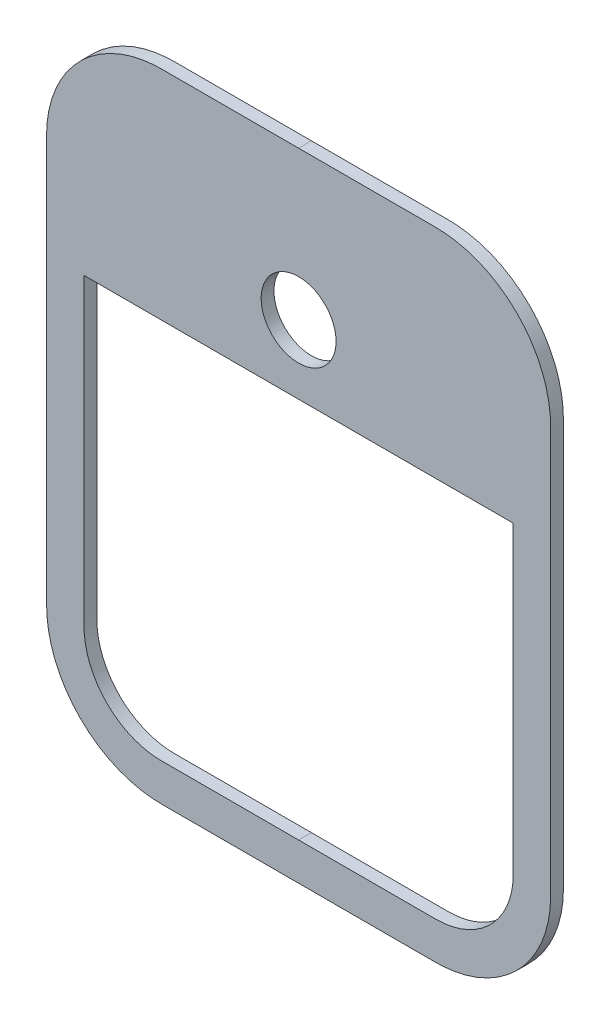
from build123d import *

# Parameters (mm, degrees)
SKETCH_1_R      = 8.2
EXTRUDE_1_DEPTH = 1.4


with BuildPart() as part:
    # Эскиз1 → Бобышка-Вытянуть1 (new, symmetric)
    # profile 1 of 2: a face of its own
    with BuildSketch(Plane.XY):
        with BuildLine():
            add(Edge.make_bspline(
                [(0, 136.205165198), (-2.37042379, 136.205165198), (-7.111202575, 136.205106755), (-14.222783524, 136.205369748), (-20.14789707, 136.204566159), (-24.890670897, 136.206202559), (-28.440424626, 136.201205693), (-32.018143408, 136.219965858), (-35.574450555, 135.66555445), (-39.012954408, 134.629996863), (-43.356980775, 132.607591094), (-48.165067718, 128.962283884), (-51.754969573, 124.112531724), (-53.726745969, 119.745405892), (-54.724040389, 116.295495654), (-55.232371711, 112.731998836), (-55.191339866, 109.158613452), (-55.202268827, 105.607705457), (-55.198690162, 100.86530983), (-55.200444409, 94.940009072), (-55.19988305, 87.828495474), (-55.20007017, 78.346878276), (-55.19995322, 66.494731483), (-55.20007017, 54.642584691), (-55.19988305, 45.160967492), (-55.200444409, 38.049453894), (-55.198690162, 32.124153137), (-55.202268827, 27.381757509), (-55.191339866, 23.830849514), (-55.232371711, 20.257464131), (-54.724040389, 16.693967312), (-53.726745969, 13.244057074), (-51.754969573, 8.876931242), (-48.165067718, 4.027179082), (-43.356980775, 0.381871873), (-39.012954408, -1.640533897), (-35.574450555, -2.676091484), (-32.018143408, -3.230502891), (-28.440424626, -3.211742727), (-24.890670897, -3.216739593), (-20.14789707, -3.215103193), (-14.222783524, -3.215906782), (-7.111202575, -3.215643789), (-2.37042379, -3.215702232), (0, -3.215702232)],
                knots=[0, 0, 0, 0, 0.03125, 0.0625, 0.09375, 0.109375, 0.125, 0.140625, 0.15625, 0.171875, 0.1875, 0.21875, 0.25, 0.265625, 0.28125, 0.296875, 0.3125, 0.328125, 0.34375, 0.375, 0.40625, 0.4375, 0.5, 0.5625, 0.59375, 0.625, 0.65625, 0.671875, 0.6875, 0.703125, 0.71875, 0.734375, 0.75, 0.78125, 0.8125, 0.828125, 0.84375, 0.859375, 0.875, 0.890625, 0.90625, 0.9375, 0.96875, 1, 1, 1, 1], degree=3))
            add(Edge.make_bspline(
                [(0, -3.215702232), (2.37042379, -3.215702232), (7.111202575, -3.215643789), (14.222783524, -3.215906782), (20.14789707, -3.215103193), (24.890670897, -3.216739593), (28.440424626, -3.211742727), (32.018143408, -3.230502891), (35.574450555, -2.676091484), (39.012954408, -1.640533897), (43.356980775, 0.381871873), (48.165067718, 4.027179082), (51.754969573, 8.876931242), (53.726745969, 13.244057074), (54.724040389, 16.693967312), (55.232371711, 20.257464131), (55.191339866, 23.830849514), (55.202268827, 27.381757509), (55.198690162, 32.124153137), (55.200444409, 38.049453894), (55.19988305, 45.160967492), (55.20007017, 54.642584691), (55.19995322, 66.494731483), (55.20007017, 78.346878276), (55.19988305, 87.828495474), (55.200444409, 94.940009072), (55.198690162, 100.86530983), (55.202268827, 105.607705457), (55.191339866, 109.158613452), (55.232371711, 112.731998836), (54.724040389, 116.295495654), (53.726745969, 119.745405892), (51.754969573, 124.112531724), (48.165067718, 128.962283884), (43.356980775, 132.607591094), (39.012954408, 134.629996863), (35.574450555, 135.66555445), (32.018143408, 136.219965858), (28.440424626, 136.201205693), (24.890670897, 136.206202559), (20.14789707, 136.204566159), (14.222783524, 136.205369748), (7.111202575, 136.205106755), (2.37042379, 136.205165198), (0, 136.205165198)],
                knots=[0, 0, 0, 0, 0.03125, 0.0625, 0.09375, 0.109375, 0.125, 0.140625, 0.15625, 0.171875, 0.1875, 0.21875, 0.25, 0.265625, 0.28125, 0.296875, 0.3125, 0.328125, 0.34375, 0.375, 0.40625, 0.4375, 0.5, 0.5625, 0.59375, 0.625, 0.65625, 0.671875, 0.6875, 0.703125, 0.71875, 0.734375, 0.75, 0.78125, 0.8125, 0.828125, 0.84375, 0.859375, 0.875, 0.890625, 0.90625, 0.9375, 0.96875, 1, 1, 1, 1], degree=3))
        make_face()
        with BuildLine():
            add(Edge.make_bspline(
                [(0, 4.984297768), (2.37042379, 4.984297768), (7.111276748, 4.984297736), (13.037316056, 4.984297855), (17.778203974, 4.984297618), (20.741131183, 4.984298219), (23.111765404, 4.984296986), (24.888940349, 4.984300752), (26.669171945, 4.984286613), (28.143176701, 4.984330606), (29.193638048, 4.984252104), (29.693381108, 4.984362158), (30.019976191, 4.984184709), (30.190434528, 4.98491178), (30.457102871, 4.989488256), (30.853917852, 5.003810956), (31.359926967, 5.03520674), (31.961162219, 5.094274236), (32.760894573, 5.201478452), (34.145142461, 5.462928318), (36.081410013, 6.047696592), (39.010301866, 7.411036383), (42.254095787, 9.870032114), (44.67625635, 13.142689017), (46.005496468, 16.086795153), (46.568001427, 18.029390949), (46.813468913, 19.41687133), (46.911496426, 20.217871664), (46.963639674, 20.820007508), (46.989223321, 21.325361879), (46.997721568, 21.674134537), (46.999616457, 21.855301499), (47.000027494, 21.947801949), (46.999966364, 22.14861745), (47.000012874, 22.498249155), (46.999992568, 23.083742615), (47.000002521, 23.827986136), (46.999999341, 24.715781241), (47.000000376, 25.901355742), (46.99999973, 27.975250245), (47.000000092, 30.938406753), (46.999999976, 34.494001915), (47.000000014, 39.23486276), (46.999999995, 45.160915726), (47.000000001, 52.272189184), (47, 59.383460003), (47, 66.494731483), (47, 73.606002963), (47.000000001, 80.669302332), (47, 85.954784691), (47, 90.695632571), (47.00000001, 94.299236223), (46.999999976, 98.495461052), (47.000000092, 102.051056214), (46.99999973, 105.014212722), (47.000000376, 107.088107224), (46.999999341, 108.273681725), (47.000002521, 109.16147683), (46.999992568, 109.905720351), (47.000012874, 110.491213812), (46.999966364, 110.840845516), (47.000027494, 111.041661017), (46.999616457, 111.134161467), (46.997721568, 111.31532843), (46.989223321, 111.664101087), (46.963639674, 112.169455459), (46.911496426, 112.771591302), (46.813468913, 113.572591637), (46.568001427, 114.960072017), (46.005496468, 116.902667814), (44.67625635, 119.846773949), (42.254095787, 123.119430852), (39.010301866, 125.578426583), (36.081410013, 126.941766374), (34.145142461, 127.526534649), (32.760894573, 127.787984514), (31.961162219, 127.89518873), (31.359926967, 127.954256226), (30.853917852, 127.98565201), (30.457102871, 127.99997471), (30.190434528, 128.004551186), (30.019976191, 128.005278257), (29.693381108, 128.005100808), (29.193638048, 128.005210862), (28.143176701, 128.00513236), (26.669171945, 128.005176354), (24.888940349, 128.005162214), (23.111765404, 128.00516598), (20.741131183, 128.005164747), (17.778203974, 128.005165348), (13.037316056, 128.005165112), (7.111276748, 128.00516523), (2.37042379, 128.005165198), (0, 128.005165198)],
                knots=[0, 0, 0, 0, 0.03125, 0.0625, 0.078125, 0.09375, 0.1015625, 0.109375, 0.1171875, 0.125, 0.12890625, 0.130859375, 0.131835938, 0.1328125, 0.134765625, 0.13671875, 0.140625, 0.14453125, 0.1484375, 0.15625, 0.171875, 0.1875, 0.21875, 0.25, 0.265625, 0.28125, 0.2890625, 0.29296875, 0.296875, 0.30078125, 0.302734375, 0.303710938, 0.304199219, 0.3046875, 0.306640625, 0.30859375, 0.3125, 0.31640625, 0.3203125, 0.328125, 0.34375, 0.359375, 0.375, 0.40625, 0.4375, 0.46875, 0.5, 0.53125, 0.5625, 0.593117578, 0.600930078, 0.625, 0.640625, 0.65625, 0.671875, 0.6796875, 0.68359375, 0.6875, 0.69140625, 0.693359375, 0.6953125, 0.695800781, 0.696289062, 0.697265625, 0.69921875, 0.703125, 0.70703125, 0.7109375, 0.71875, 0.734375, 0.75, 0.78125, 0.8125, 0.828125, 0.84375, 0.8515625, 0.85546875, 0.859375, 0.86328125, 0.865234375, 0.8671875, 0.868164062, 0.869140625, 0.87109375, 0.875, 0.8828125, 0.890625, 0.8984375, 0.90625, 0.921875, 0.9375, 0.96875, 1, 1, 1, 1], degree=3))
            add(Edge.make_bspline(
                [(0, 128.005165198), (-2.37042379, 128.005165198), (-7.111276748, 128.00516523), (-13.037316056, 128.005165112), (-17.778203974, 128.005165348), (-20.741131183, 128.005164747), (-23.111765404, 128.00516598), (-24.888940349, 128.005162214), (-26.669171945, 128.005176354), (-28.143176701, 128.00513236), (-29.193638048, 128.005210862), (-29.693381108, 128.005100808), (-30.019976191, 128.005278257), (-30.190434528, 128.004551186), (-30.457102871, 127.99997471), (-30.853917852, 127.98565201), (-31.359926967, 127.954256226), (-31.961162219, 127.89518873), (-32.760894573, 127.787984514), (-34.145142461, 127.526534649), (-36.081410013, 126.941766374), (-39.010301866, 125.578426583), (-42.254095787, 123.119430852), (-44.67625635, 119.846773949), (-46.005496468, 116.902667814), (-46.568001427, 114.960072017), (-46.813468913, 113.572591637), (-46.911496426, 112.771591302), (-46.963639674, 112.169455459), (-46.989223321, 111.664101087), (-46.997721568, 111.31532843), (-46.999616457, 111.134161467), (-47.000027494, 111.041661017), (-46.999966364, 110.840845516), (-47.000012874, 110.491213812), (-46.999992568, 109.905720351), (-47.000002521, 109.16147683), (-46.999999341, 108.273681725), (-47.000000376, 107.088107224), (-46.99999973, 105.014212722), (-47.000000092, 102.051056214), (-46.999999976, 98.495461052), (-47.00000001, 94.299236223), (-47, 90.695632571), (-47, 85.954784691), (-47.000000001, 80.669302332), (-47, 73.606002963), (-47, 66.494731483), (-47, 59.383460003), (-47.000000001, 52.272189184), (-46.999999995, 45.160915726), (-47.000000014, 39.23486276), (-46.999999976, 34.494001915), (-47.000000092, 30.938406753), (-46.99999973, 27.975250245), (-47.000000376, 25.901355742), (-46.999999341, 24.715781241), (-47.000002521, 23.827986136), (-46.999992568, 23.083742615), (-47.000012874, 22.498249155), (-46.999966364, 22.14861745), (-47.000027494, 21.947801949), (-46.999616457, 21.855301499), (-46.997721568, 21.674134537), (-46.989223321, 21.325361879), (-46.963639674, 20.820007508), (-46.911496426, 20.217871664), (-46.813468913, 19.41687133), (-46.568001427, 18.029390949), (-46.005496468, 16.086795153), (-44.67625635, 13.142689017), (-42.254095787, 9.870032114), (-39.010301866, 7.411036383), (-36.081410013, 6.047696592), (-34.145142461, 5.462928318), (-32.760894573, 5.201478452), (-31.961162219, 5.094274236), (-31.359926967, 5.03520674), (-30.853917852, 5.003810956), (-30.457102871, 4.989488256), (-30.190434528, 4.98491178), (-30.019976191, 4.984184709), (-29.693381108, 4.984362158), (-29.193638048, 4.984252104), (-28.143176701, 4.984330606), (-26.669171945, 4.984286613), (-24.888940349, 4.984300752), (-23.111765404, 4.984296986), (-20.741131183, 4.984298219), (-17.778203974, 4.984297618), (-13.037316056, 4.984297855), (-7.111276748, 4.984297736), (-2.37042379, 4.984297768), (0, 4.984297768)],
                knots=[0, 0, 0, 0, 0.03125, 0.0625, 0.078125, 0.09375, 0.1015625, 0.109375, 0.1171875, 0.125, 0.12890625, 0.130859375, 0.131835938, 0.1328125, 0.134765625, 0.13671875, 0.140625, 0.14453125, 0.1484375, 0.15625, 0.171875, 0.1875, 0.21875, 0.25, 0.265625, 0.28125, 0.2890625, 0.29296875, 0.296875, 0.30078125, 0.302734375, 0.303710938, 0.304199219, 0.3046875, 0.306640625, 0.30859375, 0.3125, 0.31640625, 0.3203125, 0.328125, 0.34375, 0.359375, 0.375, 0.399069922, 0.406882422, 0.4375, 0.46875, 0.5, 0.53125, 0.5625, 0.59375, 0.625, 0.640625, 0.65625, 0.671875, 0.6796875, 0.68359375, 0.6875, 0.69140625, 0.693359375, 0.6953125, 0.695800781, 0.696289062, 0.697265625, 0.69921875, 0.703125, 0.70703125, 0.7109375, 0.71875, 0.734375, 0.75, 0.78125, 0.8125, 0.828125, 0.84375, 0.8515625, 0.85546875, 0.859375, 0.86328125, 0.865234375, 0.8671875, 0.868164062, 0.869140625, 0.87109375, 0.875, 0.8828125, 0.890625, 0.8984375, 0.90625, 0.921875, 0.9375, 0.96875, 1, 1, 1, 1], degree=3))
        make_face(mode=Mode.SUBTRACT)
    # profile 2 of 2: a face of its own
    with BuildSketch(Plane.XY):
        with BuildLine():
            add(Edge.make_bspline(
                [(0, 128.005165198), (-2.37042379, 128.005165198), (-7.111276748, 128.00516523), (-13.037316056, 128.005165112), (-17.778203974, 128.005165348), (-20.741131183, 128.005164747), (-23.111765404, 128.00516598), (-24.888940349, 128.005162214), (-26.669171945, 128.005176354), (-28.143176701, 128.00513236), (-29.193638048, 128.005210862), (-29.693381108, 128.005100808), (-30.019976191, 128.005278257), (-30.190434528, 128.004551186), (-30.457102871, 127.99997471), (-30.853917852, 127.98565201), (-31.359926967, 127.954256226), (-31.961162219, 127.89518873), (-32.760894573, 127.787984514), (-34.145142461, 127.526534649), (-36.081410013, 126.941766374), (-39.010301866, 125.578426583), (-42.254095787, 123.119430852), (-44.67625635, 119.846773949), (-46.005496468, 116.902667814), (-46.568001427, 114.960072017), (-46.813468913, 113.572591637), (-46.911496426, 112.771591302), (-46.963639674, 112.169455459), (-46.989223321, 111.664101087), (-46.997721568, 111.31532843), (-46.999616457, 111.134161467), (-47.000027494, 111.041661017), (-46.999966364, 110.840845516), (-47.000012874, 110.491213812), (-46.999992568, 109.905720351), (-47.000002521, 109.16147683), (-46.999999341, 108.273681725), (-47.000000376, 107.088107224), (-46.99999973, 105.014212722), (-47.000000092, 102.051056214), (-46.999999976, 98.495461052), (-47.00000001, 94.299236223), (-47, 90.991935258), (-47, 88.869843121), (-47, 88.573540147)],
                knots=[0, 0, 0, 0, 0.03125, 0.0625, 0.078125, 0.09375, 0.1015625, 0.109375, 0.1171875, 0.125, 0.12890625, 0.130859375, 0.131835938, 0.1328125, 0.134765625, 0.13671875, 0.140625, 0.14453125, 0.1484375, 0.15625, 0.171875, 0.1875, 0.21875, 0.25, 0.265625, 0.28125, 0.2890625, 0.29296875, 0.296875, 0.30078125, 0.302734375, 0.303710938, 0.304199219, 0.3046875, 0.306640625, 0.30859375, 0.3125, 0.31640625, 0.3203125, 0.328125, 0.34375, 0.359375, 0.375, 0.399069922, 0.402976172, 0.402976172, 0.402976172, 0.402976172], degree=3))
            Line((-47, 88.573540147), (47, 88.573540147))
            add(Edge.make_bspline(
                [(47, 88.573540147), (47, 88.869843121), (47, 90.991935258), (47.00000001, 94.299236223), (46.999999976, 98.495461052), (47.000000092, 102.051056214), (46.99999973, 105.014212722), (47.000000376, 107.088107224), (46.999999341, 108.273681725), (47.000002521, 109.16147683), (46.999992568, 109.905720351), (47.000012874, 110.491213812), (46.999966364, 110.840845516), (47.000027494, 111.041661017), (46.999616457, 111.134161467), (46.997721568, 111.31532843), (46.989223321, 111.664101087), (46.963639674, 112.169455459), (46.911496426, 112.771591302), (46.813468913, 113.572591637), (46.568001427, 114.960072017), (46.005496468, 116.902667814), (44.67625635, 119.846773949), (42.254095787, 123.119430852), (39.010301866, 125.578426583), (36.081410013, 126.941766374), (34.145142461, 127.526534649), (32.760894573, 127.787984514), (31.961162219, 127.89518873), (31.359926967, 127.954256226), (30.853917852, 127.98565201), (30.457102871, 127.99997471), (30.190434528, 128.004551186), (30.019976191, 128.005278257), (29.693381108, 128.005100808), (29.193638048, 128.005210862), (28.143176701, 128.00513236), (26.669171945, 128.005176354), (24.888940349, 128.005162214), (23.111765404, 128.00516598), (20.741131183, 128.005164747), (17.778203974, 128.005165348), (13.037316056, 128.005165112), (7.111276748, 128.00516523), (2.37042379, 128.005165198), (0, 128.005165198)],
                knots=[0.597023828, 0.597023828, 0.597023828, 0.597023828, 0.600930078, 0.625, 0.640625, 0.65625, 0.671875, 0.6796875, 0.68359375, 0.6875, 0.69140625, 0.693359375, 0.6953125, 0.695800781, 0.696289062, 0.697265625, 0.69921875, 0.703125, 0.70703125, 0.7109375, 0.71875, 0.734375, 0.75, 0.78125, 0.8125, 0.828125, 0.84375, 0.8515625, 0.85546875, 0.859375, 0.86328125, 0.865234375, 0.8671875, 0.868164062, 0.869140625, 0.87109375, 0.875, 0.8828125, 0.890625, 0.8984375, 0.90625, 0.921875, 0.9375, 0.96875, 1, 1, 1, 1], degree=3))
        make_face()
        with Locations((0, 103.636945021)):
            Circle(SKETCH_1_R, mode=Mode.SUBTRACT)
    extrude(amount=EXTRUDE_1_DEPTH, both=True)


solid = part.part
